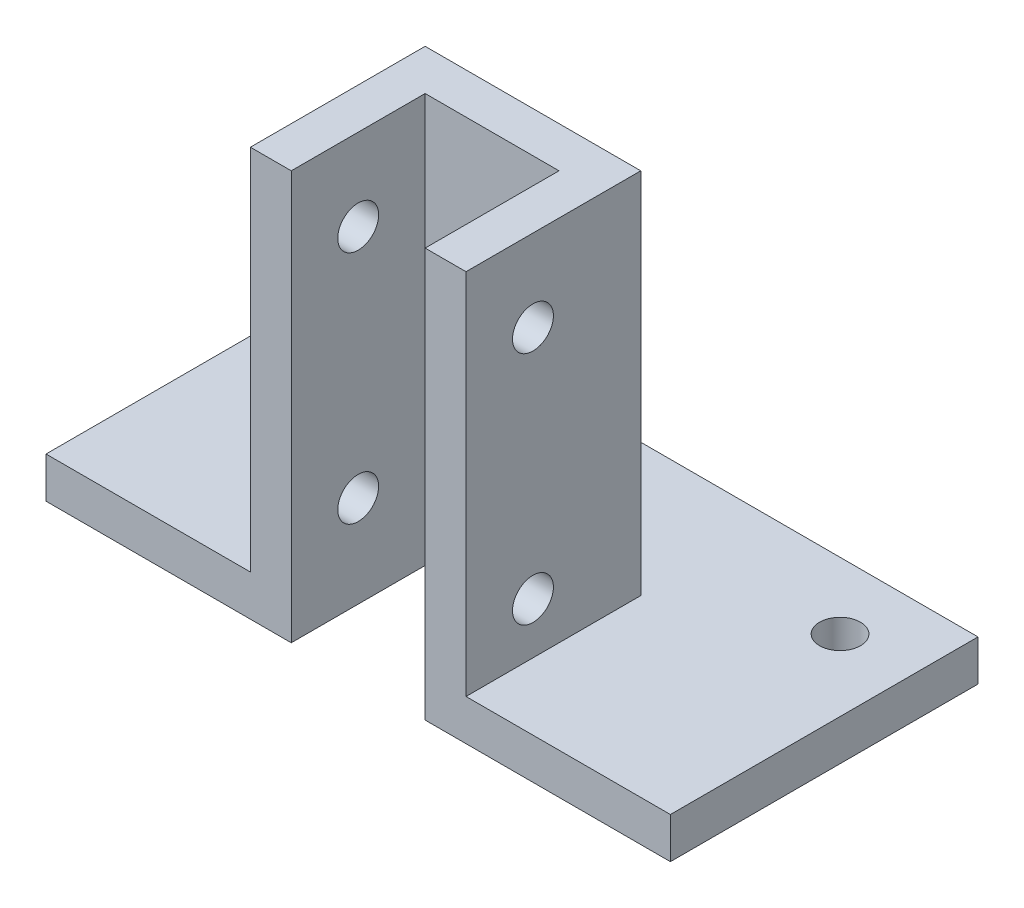
from build123d import *

# Parameters (mm, degrees)
SKETCH1_W           = 13.1
SKETCH1_H           = 4
BOSS_EXTRUDE1_DEPTH = 40
SKETCH2_W           = 21.1
SKETCH2_H           = 13
BOSS_EXTRUDE2_DEPTH = 4
SKETCH3_R           = 2
CUT_EXTRUDE1_DEPTH  = 50.571287052
SKETCH4_R           = 2
CUT_EXTRUDE2_DEPTH  = 60.306154824


with BuildPart() as part:
    # Sketch1 → Boss-Extrude1 (new body)
    with BuildSketch(Plane(origin=(0, 0, 0), x_dir=(1, 0, 0), z_dir=(0, 1, 0))):
        Polygon((-6.55, -15.1), (-6.55, -2), (-6.55, 2), (-10.55, 2), (-10.55, -15.1), align=None)
        Rectangle(SKETCH1_W, SKETCH1_H)
        Polygon((6.55, 2), (6.55, -2), (6.55, -15.1), (10.55, -15.1), (10.55, 2), align=None)
    extrude(amount=BOSS_EXTRUDE1_DEPTH)

    # Sketch2 → Boss-Extrude2 (add)
    with BuildSketch(Plane.XZ):
        Polygon((30.55, 15.1), (10.55, 15.1), (10.55, -2), (10.55, -15), (30.55, -15), align=None)
        with Locations((0, -8.5)):
            Rectangle(SKETCH2_W, SKETCH2_H)
        Polygon((-10.55, -15), (-10.55, -2), (-10.55, 15.1), (-30.55, 15.1), (-30.55, -15), align=None)
    extrude(amount=-BOSS_EXTRUDE2_DEPTH)

    # Sketch3 → Cut-Extrude1 (cut, through all)
    with BuildSketch(Plane(origin=(0, 4, 0), x_dir=(1, 0, 0), z_dir=(0, 1, 0))):
        with Locations(Location((-23.55, 8.5, 0), (0, 0, 270))):
            Circle(SKETCH3_R)
        with Locations(Location((23.55, 8.5, 0), (0, 0, 270))):
            Circle(SKETCH3_R)
    extrude(amount=-CUT_EXTRUDE1_DEPTH, mode=Mode.SUBTRACT)

    # Sketch4 → Cut-Extrude2 (cut, through all)
    with BuildSketch(Plane.ZY.offset(10.55)):
        with Locations((8.55, 9)):
            Circle(SKETCH4_R)
        with Locations((8.55, 32)):
            Circle(SKETCH4_R)
    extrude(amount=-CUT_EXTRUDE2_DEPTH, mode=Mode.SUBTRACT)


solid = part.part
